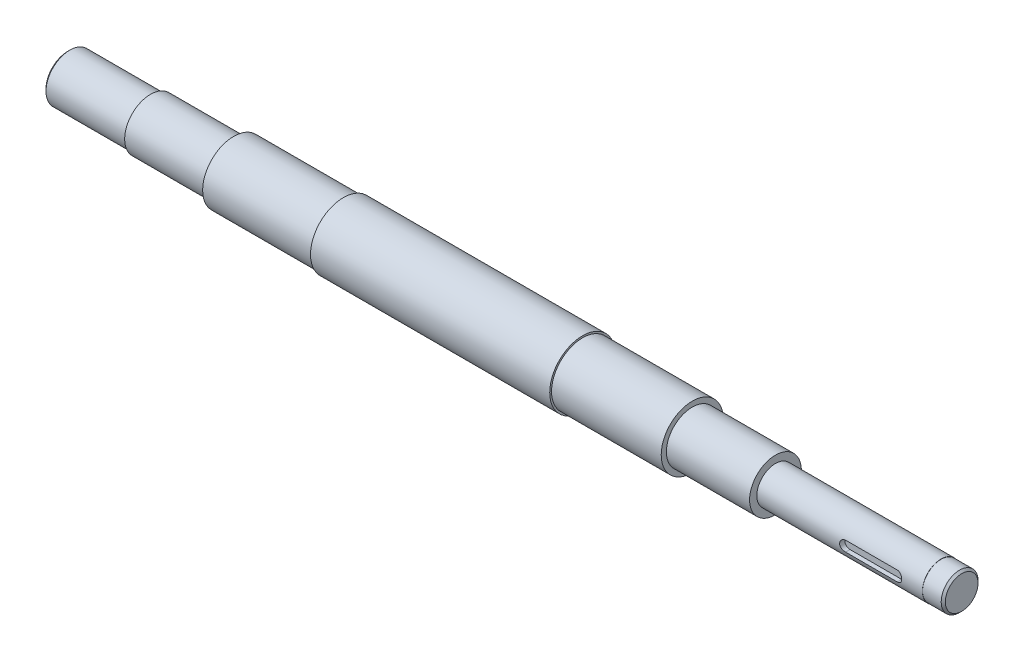
from build123d import *

# Parameters (mm, degrees)
CUT_EXTRUDE_START   = 9
CUT_EXTRUDE_1_DEPTH = 2.5


with BuildPart() as part:
    # 草圖1 → 旋轉1 (revolve)
    with BuildSketch(Plane.XY, mode=Mode.PRIVATE) as revolve_1_sk:
        Polygon((57.8, 15.875), (-57.8, 15.875), (-57.8, 15), (-110.8, 15), (-110.8, 12.5), (-151, 12.5), (-151, 11.5), (-190, 11.5), (-191, 10.5), (-191, 0), (241, 0), (241, 7.9), (240, 8.9), (231, 8.9), (231, 9), (151, 9), (151, 12.5), (110.8, 12.5), (110.8, 15), (57.8, 15), align=None)
    revolve(revolve_1_sk.sketch.rotate(Axis((0, 0, 0), (1, 0, 0)), 90), axis=Axis((0, 0, 0), (1, 0, 0)))

    # 草圖2 → 除料-伸長1 (cut)
    with BuildSketch(Plane.XY.offset(CUT_EXTRUDE_START)):
        with BuildLine():
            Line((193.5, 2.5), (218.5, 2.5))
            ThreePointArc((218.5, 2.5), (221, 0), (218.5, -2.5))
            Line((218.5, -2.5), (193.5, -2.5))
            ThreePointArc((193.5, -2.5), (191, 0), (193.5, 2.5))
        make_face()
    extrude(amount=-CUT_EXTRUDE_1_DEPTH, mode=Mode.SUBTRACT)


solid = part.part
